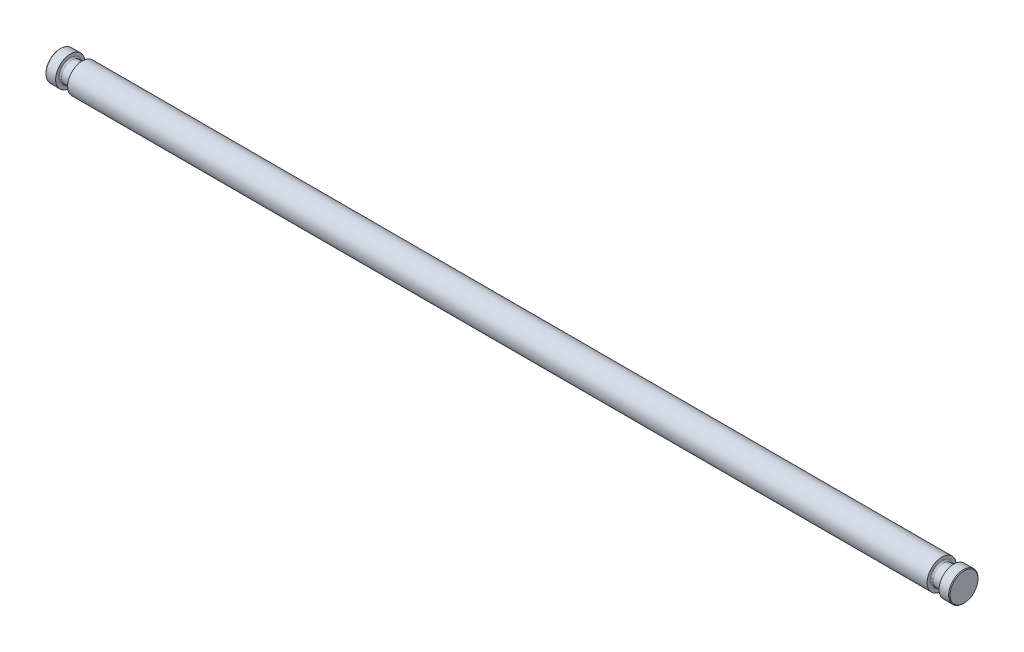
from build123d import *

# Parameters (mm, degrees)
CUT_EXTRUDE2_START = -24.60625
SKETCH2_W          = 1882.3686
SKETCH2_H          = 12.7
CUT_EXTRUDE2_DEPTH = 63.4619
FILLET1_R          = 3.175
CHAMFER1_SIZE      = 1.524


with BuildPart() as part:
    # Sketch1 → Revolve1 (revolve)
    with BuildSketch(Plane(origin=(0, 0, 0), x_dir=(1, 0, 0), z_dir=(0, 1, 0)), mode=Mode.PRIVATE) as revolve1_sk:
        Polygon((-976.376, 0), (-976.376, 31.73095), (-954.024, 31.73095), (-954.024, 22.0218), (-928.2176, 22.0218), (-928.2176, 31.73095), (928.3446, 31.73095), (928.3446, 22.0218), (954.151, 22.0218), (954.151, 31.73095), (976.376, 31.73095), (976.376, 0), align=None)
    revolve(revolve1_sk.sketch.rotate(Axis((-1001.776, 0, 0), (1, 0, 0)), 180), axis=Axis((-1001.776, 0, 0), (1, 0, 0)))

    # Sketch2 → Cut-Extrude2 (cut)
    with BuildSketch(Plane.XY.offset(CUT_EXTRUDE2_START)):
        with Locations((0.0635, 0)):
            Rectangle(SKETCH2_W, SKETCH2_H)
    extrude(amount=-CUT_EXTRUDE2_DEPTH, mode=Mode.SUBTRACT)

    # Fillet1
    fillet1_edges = [part.edges().sort_by_distance(p)[0] for p in [
        (954.151, 0, -22.0218),
        (928.3446, 0, -22.0218),
        (-928.2176, 0, -22.0218),
        (-954.024, 0, -22.0218),
    ]]
    fillet(fillet1_edges, radius=FILLET1_R)

    # Chamfer1
    chamfer1_edges = [part.edges().sort_by_distance(p)[0] for p in [
        (-976.376, 0, -31.73095),
        (976.376, 0, -31.73095),
    ]]
    chamfer(chamfer1_edges, length=CHAMFER1_SIZE)


solid = part.part
